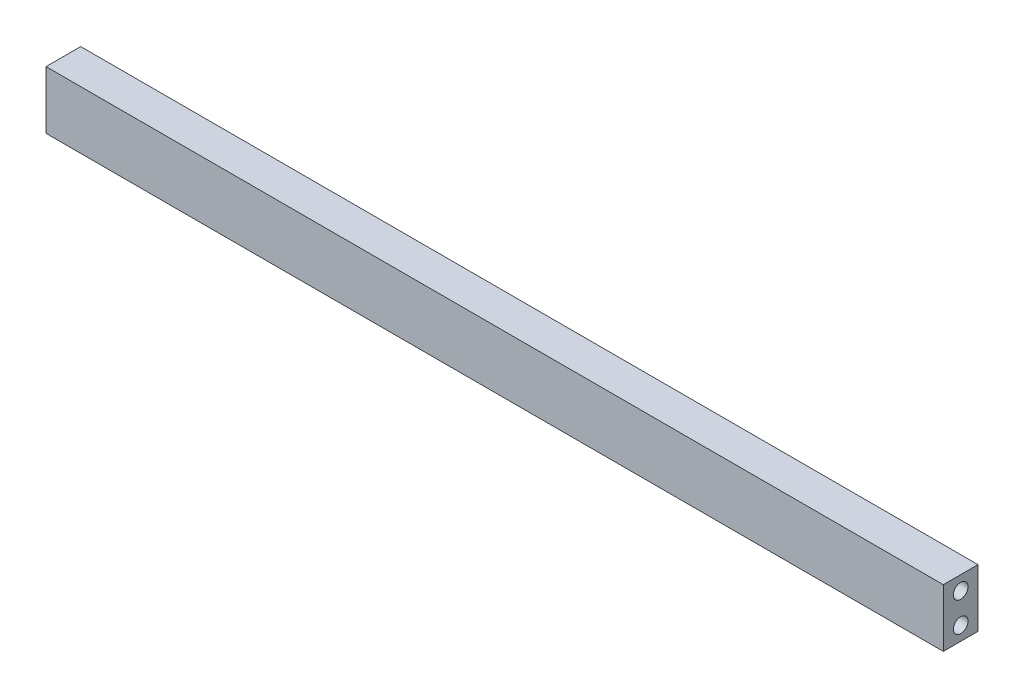
from build123d import *

# Parameters (mm, degrees)
SKETCH1_W                           = 9.525
SKETCH1_H                           = 15.875
BOSS_EXTRUDE1_DEPTH                 = 123.19
TAP_DRILL_FOR_10_32_TAP1_AT_2_COUNT = 2
TAP_DRILL_FOR_10_32_TAP1_AT_2_PITCH = 8.1788


with BuildPart() as part:
    # Sketch1 → Boss-Extrude1 (new, symmetric)
    with BuildSketch(Plane(origin=(0, 0, 0), x_dir=(0, 0, -1), z_dir=(1, 0, 0))):
        Rectangle(SKETCH1_W, SKETCH1_H)
    extrude(amount=BOSS_EXTRUDE1_DEPTH, both=True)

    # Sketch4 → Tap Drill for #10-32 Tap1 (revolve, cut)
    with BuildSketch(Plane(origin=(123.19, 4.0894, 0), x_dir=(0, 0, -1), z_dir=(0, 1, 0))):
        Polygon((0, 0), (0, 11.373317848), (2.0193, 10.16), (2.0193, 0), align=None)
    tap_drill_for_10_32_tap1 = revolve(axis=Axis((129.54, 4.0894, 0), (-1, 0, 0)), mode=Mode.SUBTRACT)

    # Tap Drill for #10-32 Tap1 at 2: Tap Drill for #10-32 Tap1 ×2
    with Locations(*[(0, -i * TAP_DRILL_FOR_10_32_TAP1_AT_2_PITCH, 0) for i in range(1, TAP_DRILL_FOR_10_32_TAP1_AT_2_COUNT)]):
        add(tap_drill_for_10_32_tap1, mode=Mode.SUBTRACT)

    # Mirror1: Tap Drill for #10-32 Tap1 across plane
    add(tap_drill_for_10_32_tap1.mirror(Plane(origin=(0, 0, 0), x_dir=(0, 0, 1), z_dir=(1, 0, 0))), mode=Mode.SUBTRACT)

    # Mirror1 copy 1 sketch → Mirror1 copy 1 (revolve, cut)
    with BuildSketch(Plane(origin=(-123.19, -4.0894, 0), x_dir=(0, 0, -1), z_dir=(0, 1, 0))):
        Polygon((0, 0), (0, -11.373317848), (2.0193, -10.16), (2.0193, 0), align=None)
    revolve(axis=Axis((-129.54, -4.0894, 0), (-1, 0, 0)), mode=Mode.SUBTRACT)


solid = part.part
